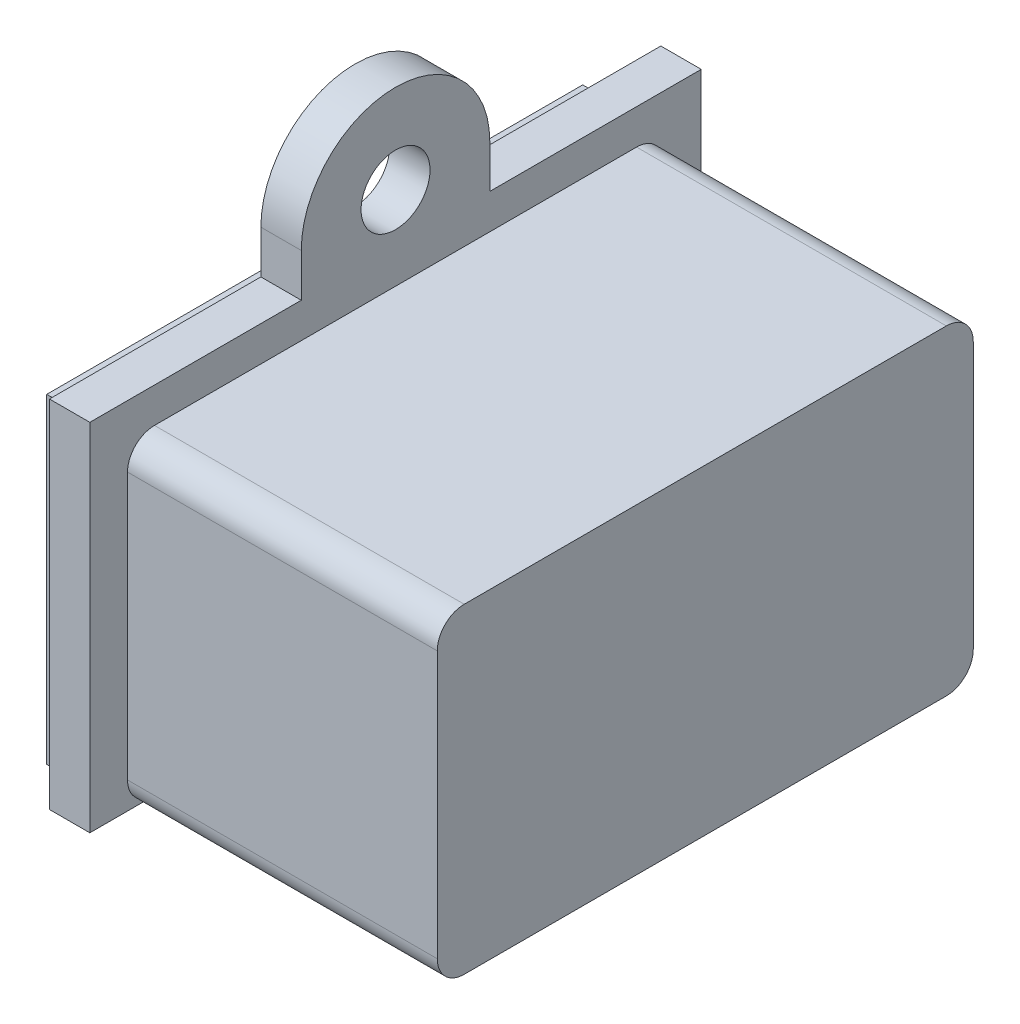
from build123d import *

# Parameters (mm, degrees)
SKETCH_1_R           = 1.28
SKETCH_1_W           = 19.318640657
SKETCH_1_H           = 10.053241434
EXTRUDE_1_DEPTH      = 1.5
EXTRUDE_2_DEPTH      = 1.5
EXTRUDE_2_DEPTH_BACK = 12
SKETCH_2_W           = 19.9
SKETCH_2_H           = 11.9
SKETCH_3_R           = 1
EXTRUDE_4_DEPTH      = 13
EXTRUDE_4_2_DEPTH    = 13
EXTRUDE_4_3_DEPTH    = 13
EXTRUDE_4_4_DEPTH    = 13
SKETCH_10_W          = 19.9
SKETCH_10_H          = 11.9
EXTRUDE_6_DEPTH      = 1
FILLET_2_R           = 1
SKETCH_11_R          = 1.5
EXTRUDE_7_DEPTH      = 1
FILLET_3_R           = 0.2
FILLET_4_R           = 0.2


with BuildPart() as part:
    # 草图1 → 凸台-拉伸1 (new body)
    with BuildSketch(Plane(origin=(0, 0, 0), x_dir=(0, 0, -1), z_dir=(1, 0, 0))):
        with BuildLine():
            Line((-3.857017018, 9.734638091), (3.992982982, 9.734638091))
            Line((3.992982982, 9.734638091), (3.992982982, -3.465361909))
            Line((3.992982982, -3.465361909), (-18.707017018, -3.465361909))
            Line((-18.707017018, -3.465361909), (-18.707017018, 9.734638091))
            Line((-18.707017018, 9.734638091), (-10.857017018, 9.734638091))
            Line((-10.857017018, 9.734638091), (-10.857017018, 11.334638091))
            ThreePointArc((-10.857017018, 11.334638091), (-7.357017018, 14.834638091), (-3.857017018, 11.334638091))
            Line((-3.857017018, 11.334638091), (-3.857017018, 9.734638091))
        make_face()
        with Locations((-7.357017018, 11.534638091)):
            Circle(SKETCH_1_R, mode=Mode.SUBTRACT)
        with Locations((-7.500203857, 3.102012995)):
            Rectangle(SKETCH_1_W, SKETCH_1_H, mode=Mode.SUBTRACT)
    extrude(amount=EXTRUDE_1_DEPTH)

    # 草图2 → 凸台-拉伸2 (add, two sides: drawn at the far end of the back side and taken through both)
    with BuildSketch(Plane.ZY.offset(-EXTRUDE_2_DEPTH_BACK)):
        with Locations((7.357017018, 2.484638091)):
            Rectangle(SKETCH_2_W, SKETCH_2_H)
        with BuildLine():
            Line((2.007017018, 6.734638091), (12.707017018, 6.734638091))
            ThreePointArc((12.707017018, 6.734638091), (14.828337361, 5.855958435), (15.707017018, 3.734638091))
            Line((15.707017018, 3.734638091), (15.707017018, 1.234638091))
            ThreePointArc((15.707017018, 1.234638091), (14.828337361, -0.886682253), (12.707017018, -1.765361909))
            Line((12.707017018, -1.765361909), (2.007017018, -1.765361909))
            ThreePointArc((2.007017018, -1.765361909), (-0.114303326, -0.886682253), (-0.992982982, 1.234638091))
            Line((-0.992982982, 1.234638091), (-0.992982982, 3.734638091))
            ThreePointArc((-0.992982982, 3.734638091), (-0.114303326, 5.855958435), (2.007017018, 6.734638091))
        make_face(mode=Mode.SUBTRACT)
    extrude(amount=EXTRUDE_2_DEPTH + EXTRUDE_2_DEPTH_BACK)

    # 草图10 → 凸台-拉伸6 (add)
    with BuildSketch(Plane(origin=(12, 0, 0), x_dir=(0, 0, -1), z_dir=(1, 0, 0))):
        with Locations((-7.357017018, 2.484638091)):
            Rectangle(SKETCH_10_W, SKETCH_10_H)
    extrude(amount=EXTRUDE_6_DEPTH)

    # 圆角2
    fillet_2_edges = [part.edges().sort_by_distance(p)[0] for p in [
        (7.25, -3.465361909, 17.307017018),
        (7.25, 8.434638091, -2.592982982),
        (7.25, -3.465361909, -2.592982982),
        (7.25, 8.434638091, 17.307017018),
    ]]
    fillet(fillet_2_edges, radius=FILLET_2_R)

    # 草图11 → 凸台-拉伸7 (add)
    with BuildSketch(Plane.ZY.offset(-12)):
        with Locations(Location((2.007017018, 2.484638091, 0), (0, 0, 180))):
            Circle(SKETCH_11_R)
        with Locations(Location((12.707017018, 2.484638091, 0), (0, 0, 180))):
            Circle(SKETCH_11_R)
    extrude(amount=EXTRUDE_7_DEPTH)


with BuildPart() as body_2:
    # 草图3 → 凸台-拉伸4 (new body)
    with BuildSketch(Plane.ZY.offset(1.5)):
        with Locations((2.007017018, 2.484638091)):
            Circle(SKETCH_3_R)
    extrude(amount=-EXTRUDE_4_DEPTH)

    # 圆角3
    fillet_3_edges = [body_2.edges().sort_by_distance(p)[0] for p in [
        (-1.5, 2.484638091, 1.007017018),
    ]]
    fillet(fillet_3_edges, radius=FILLET_3_R)


with BuildPart() as body_3:
    # 草图3 → Extrude 4 2 (new body)
    with BuildSketch(Plane.ZY.offset(1.5)):
        with Locations((12.707017018, 2.484638091)):
            Circle(SKETCH_3_R)
    extrude(amount=-EXTRUDE_4_2_DEPTH)

    # 圆角4
    fillet_4_edges = [body_3.edges().sort_by_distance(p)[0] for p in [
        (-1.5, 2.484638091, 11.707017018),
    ]]
    fillet(fillet_4_edges, radius=FILLET_4_R)


with BuildPart() as body_4:
    # 草图3 → Extrude 4 3 (new body)
    with BuildSketch(Plane.ZY.offset(1.5)):
        with BuildLine():
            Line((8.557017018, 6.734638091), (7.528515603, 5.020469066))
            ThreePointArc((7.528515603, 5.020469066), (7.357017018, 4.923368217), (7.185518432, 5.020469066))
            Line((7.185518432, 5.020469066), (6.157017018, 6.734638091))
            Line((6.157017018, 6.734638091), (8.557017018, 6.734638091))
        make_face()
    extrude(amount=-EXTRUDE_4_3_DEPTH)


with BuildPart() as body_5:
    # 草图3 → Extrude 4 4 (new body)
    with BuildSketch(Plane.ZY.offset(1.5)):
        with BuildLine():
            Line((6.157017018, -1.765361909), (7.185518432, -0.051192884))
            ThreePointArc((7.185518432, -0.051192884), (7.357017018, 0.045907965), (7.528515603, -0.051192884))
            Line((7.528515603, -0.051192884), (8.557017018, -1.765361909))
            Line((8.557017018, -1.765361909), (6.157017018, -1.765361909))
        make_face()
    extrude(amount=-EXTRUDE_4_4_DEPTH)


solid = Compound([part.part, body_2.part, body_3.part, body_4.part, body_5.part])
